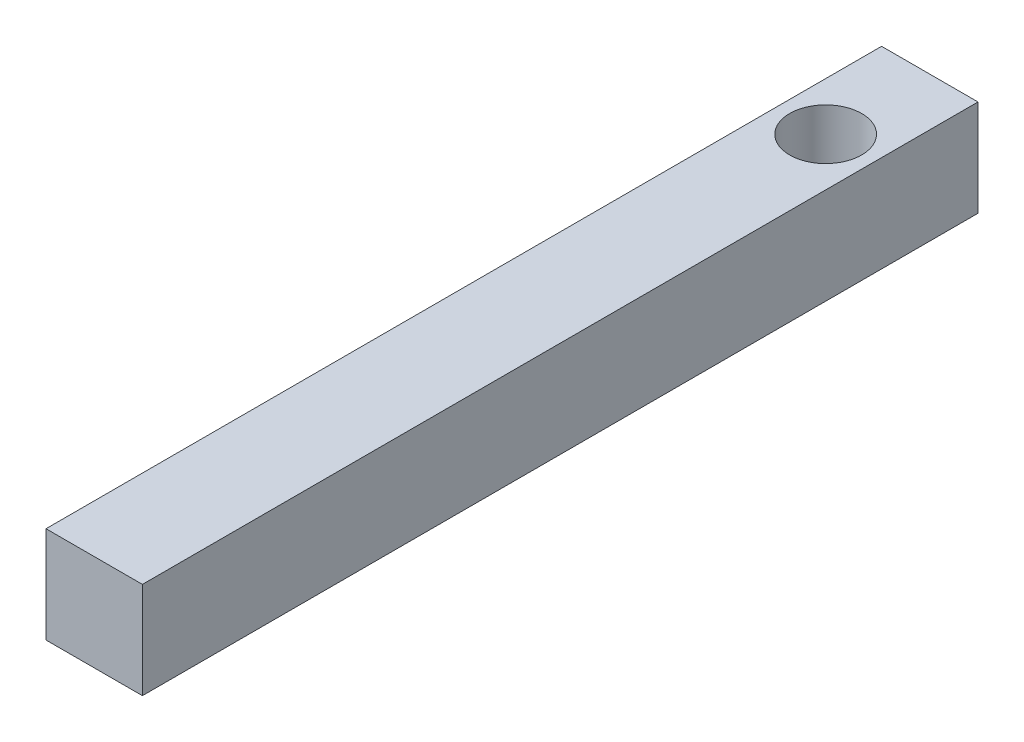
from build123d import *

# Parameters (mm, degrees)
SKETCH_2_W          = 19.05
SKETCH_2_H          = 19.05
EXTRUDE_1_DEPTH     = 165.1
SKETCH_3_R          = 7.112
CUT_EXTRUDE_1_DEPTH = 168.283636378


with BuildPart() as part:
    # 草图2 → 凸台-拉伸1 (new body)
    with BuildSketch(Plane.XY):
        with Locations((9.525, 9.525)):
            Rectangle(SKETCH_2_W, SKETCH_2_H)
    extrude(amount=EXTRUDE_1_DEPTH)

    # 草图3 → 切除-拉伸1 (cut, through all)
    with BuildSketch(Plane(origin=(0, 19.05, 0), x_dir=(1, 0, 0), z_dir=(0, 1, 0))):
        with Locations(Location((9.525, -20.574, 0), (0, 0, 270))):
            Circle(SKETCH_3_R)
    extrude(amount=-CUT_EXTRUDE_1_DEPTH, mode=Mode.SUBTRACT)


solid = part.part
